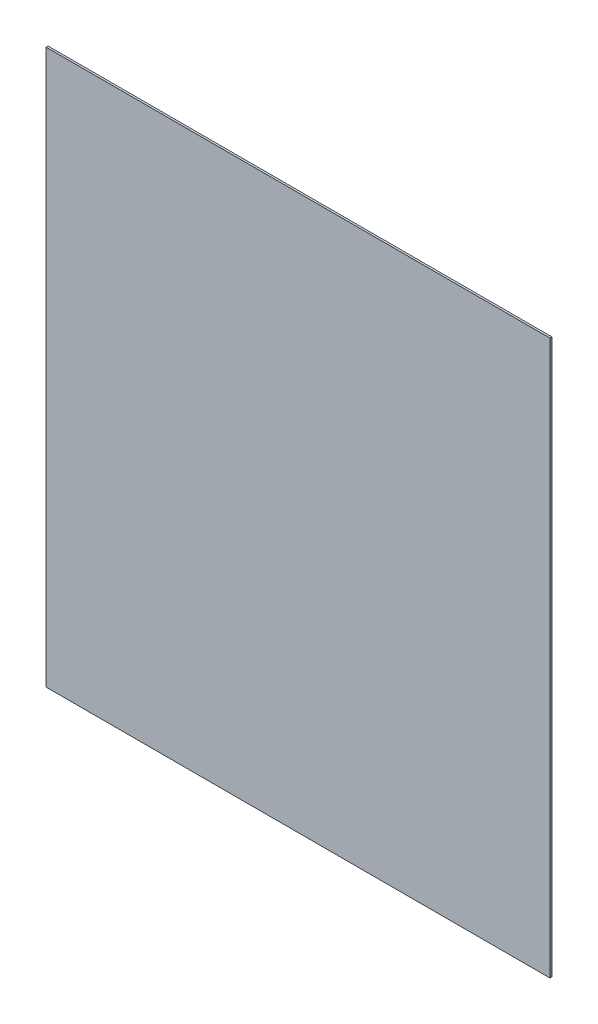
from build123d import *

# Parameters (mm, degrees)
SKETCH1_W           = 500
SKETCH1_H           = 550
BOSS_EXTRUDE1_DEPTH = 1


with BuildPart() as part:
    # Sketch1 → Boss-Extrude1 (new, symmetric)
    with BuildSketch(Plane.XY):
        Rectangle(SKETCH1_W, SKETCH1_H)
    extrude(amount=BOSS_EXTRUDE1_DEPTH, both=True)


solid = part.part
